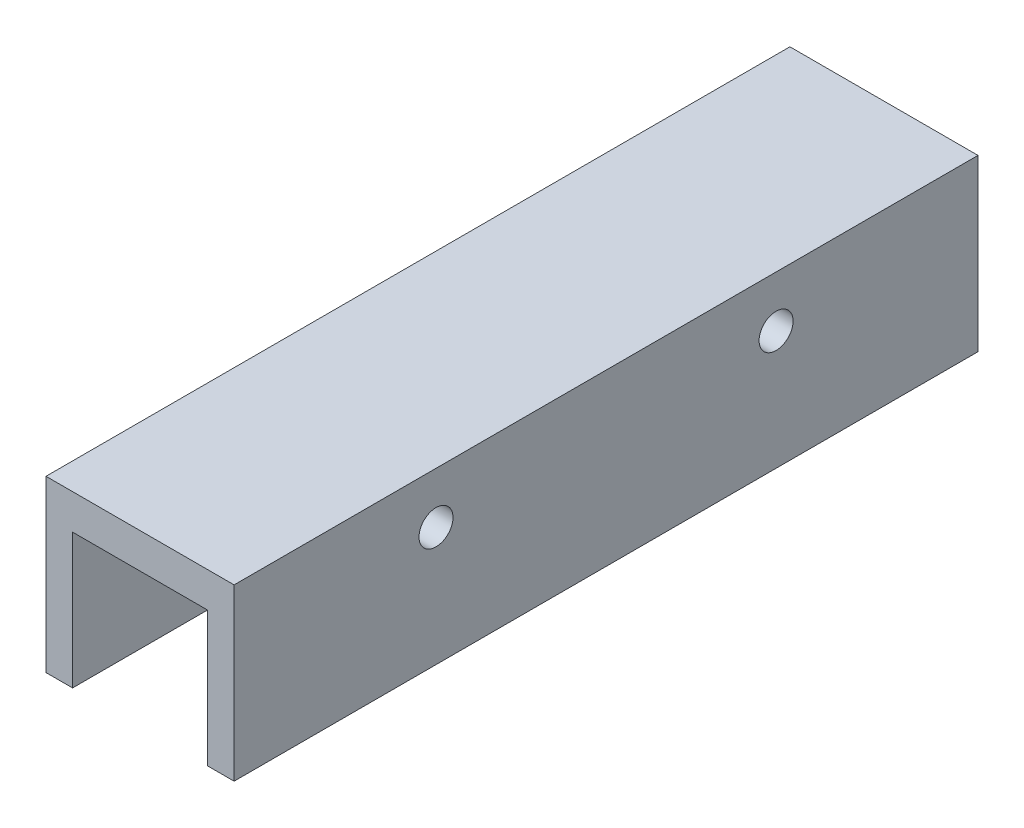
from build123d import *

# Parameters (mm, degrees)
BOSS_EXTRUDE2_DEPTH = 88.9
SKETCH19_R          = 2.032
CUT_EXTRUDE3_DEPTH  = 94.922403297


with BuildPart() as part:
    # Sketch2 → Boss-Extrude2 (new body)
    with BuildSketch(Plane.XY):
        Polygon((0, 0), (0, 20.32), (22.479, 20.32), (22.479, 0), (19.304, 0), (19.304, 16.129), (3.175, 16.129), (3.175, 0), align=None)
    extrude(amount=-BOSS_EXTRUDE2_DEPTH)

    # Sketch19 → Cut-Extrude3 (cut, through all)
    with BuildSketch(Plane(origin=(0, 0, 0), x_dir=(0, 0, -1), z_dir=(1, 0, 0))):
        with Locations((24.13, 14.224)):
            Circle(SKETCH19_R)
        with Locations((64.77, 14.224)):
            Circle(SKETCH19_R)
    extrude(amount=CUT_EXTRUDE3_DEPTH, mode=Mode.SUBTRACT)


solid = part.part
